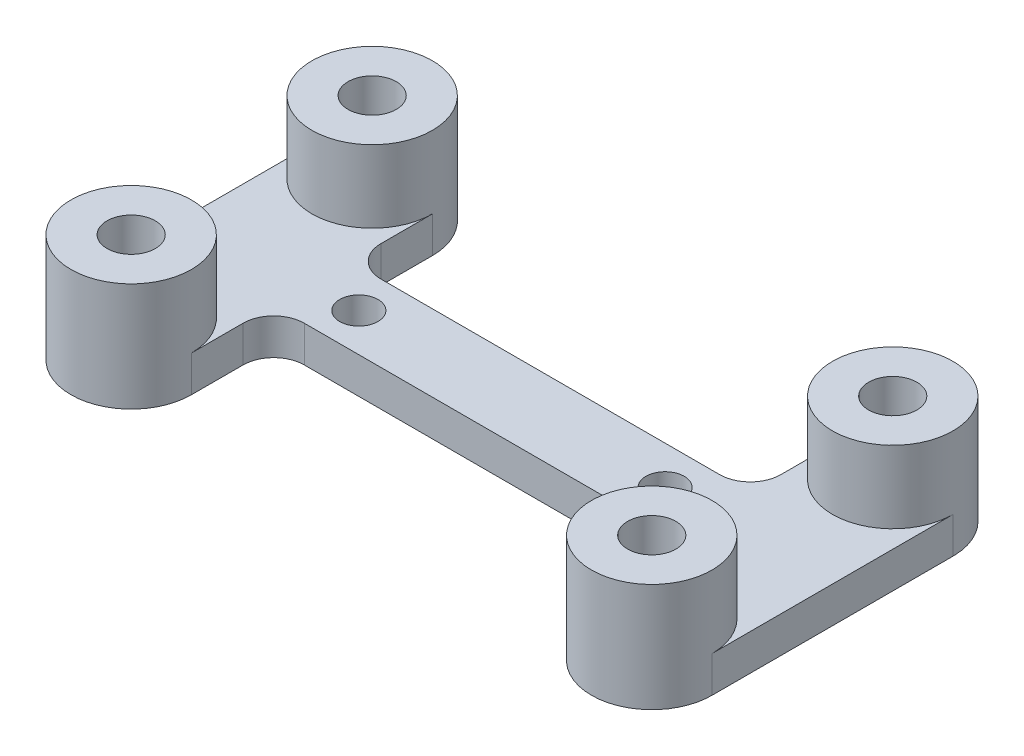
from build123d import *

# Parameters (mm, degrees)
SKETCH4_R             = 5
SKETCH4_R_2           = 2
BOSS_EXTRUDE3_DEPTH   = 9
BOSS_EXTRUDE3_2_DEPTH = 9
BOSS_EXTRUDE3_3_DEPTH = 9
BOSS_EXTRUDE3_4_DEPTH = 9
BOSS_EXTRUDE4_DEPTH   = 3
SKETCH6_R             = 1.5875
CUT_EXTRUDE1_DEPTH    = 32.110691506
FILLET1_R             = 2.54


with BuildPart() as part:
    # Sketch4 → Boss-Extrude3 (new body)
    with BuildSketch(Plane(origin=(0, 0, 0), x_dir=(1, 0, 0), z_dir=(0, 1, 0))):
        with Locations(Location((-21.59, 9.9949, 0), (0, 0, 270))):
            Circle(SKETCH4_R)
        with Locations(Location((-21.59, 9.9949, 0), (0, 0, 270))):
            Circle(SKETCH4_R_2, mode=Mode.SUBTRACT)
    extrude(amount=BOSS_EXTRUDE3_DEPTH)



with BuildPart() as body_2:
    # Sketch4 → Boss-Extrude3 2 (new body)
    with BuildSketch(Plane(origin=(0, 0, 0), x_dir=(1, 0, 0), z_dir=(0, 1, 0))):
        with Locations(Location((-21.59, -9.9949, 0), (0, 0, 270))):
            Circle(SKETCH4_R)
        with Locations(Location((-21.59, -9.9949, 0), (0, 0, 270))):
            Circle(SKETCH4_R_2, mode=Mode.SUBTRACT)
    extrude(amount=BOSS_EXTRUDE3_2_DEPTH)


with BuildPart() as body_3:
    # Sketch4 → Boss-Extrude3 3 (new body)
    with BuildSketch(Plane(origin=(0, 0, 0), x_dir=(1, 0, 0), z_dir=(0, 1, 0))):
        with Locations(Location((21.59, 9.9949, 0), (0, 0, 270))):
            Circle(SKETCH4_R)
        with Locations(Location((21.59, 9.9949, 0), (0, 0, 270))):
            Circle(SKETCH4_R_2, mode=Mode.SUBTRACT)
    extrude(amount=BOSS_EXTRUDE3_3_DEPTH)


with BuildPart() as body_4:
    # Sketch4 → Boss-Extrude3 4 (new body)
    with BuildSketch(Plane(origin=(0, 0, 0), x_dir=(1, 0, 0), z_dir=(0, 1, 0))):
        with Locations(Location((21.59, -9.9949, 0), (0, 0, 270))):
            Circle(SKETCH4_R)
        with Locations(Location((21.59, -9.9949, 0), (0, 0, 270))):
            Circle(SKETCH4_R_2, mode=Mode.SUBTRACT)
    extrude(amount=BOSS_EXTRUDE3_4_DEPTH)


with BuildPart() as part_1:
    add(part.part)

    add(body_2.part)  # Boss-Extrude4 merges body 2
    # Sketch5 → Boss-Extrude4 (add)
    with BuildSketch(Plane(origin=(0, 0, 0), x_dir=(1, 0, 0), z_dir=(0, 1, 0))):
        with BuildLine():
            ThreePointArc((-23.59, -9.9949), (-21.59, -7.9949), (-19.59, -9.9949))
            Line((-19.59, -9.9949), (-16.59, -9.9949))
            Line((-16.59, -9.9949), (-16.59, -3.175))
            Line((-16.59, -3.175), (0, -3.175))
            Line((0, -3.175), (0, 3.175))
            Line((0, 3.175), (-16.59, 3.175))
            Line((-16.59, 3.175), (-16.59, 9.9949))
            Line((-16.59, 9.9949), (-19.59, 9.9949))
            ThreePointArc((-19.59, 9.9949), (-21.59, 7.9949), (-23.59, 9.9949))
            Line((-23.59, 9.9949), (-26.59, 9.9949))
            Line((-26.59, 9.9949), (-26.59, -9.9949))
            Line((-26.59, -9.9949), (-23.59, -9.9949))
        make_face()
    boss_extrude4 = extrude(amount=BOSS_EXTRUDE4_DEPTH)

    # Mirror1: Boss-Extrude4 across plane
    add(boss_extrude4.mirror(Plane(origin=(0, 0, 0), x_dir=(0, 0, 1), z_dir=(1, 0, 0))))

    # Sketch6 → Cut-Extrude1 (cut, through all)
    with BuildSketch(Plane(origin=(0, 3, 0), x_dir=(1, 0, 0), z_dir=(0, 1, 0))):
        with Locations(Location((-12.7, 0, 0), (0, 0, 270))):
            Circle(SKETCH6_R)
        with Locations(Location((12.7, 0, 0), (0, 0, 270))):
            Circle(SKETCH6_R)
    extrude(amount=-CUT_EXTRUDE1_DEPTH, mode=Mode.SUBTRACT)

    # Fillet1
    fillet1_edges = [part_1.edges().sort_by_distance(p)[0] for p in [
        (-16.59, 1.5, 3.175),
        (-16.59, 1.5, -3.175),
        (16.59, 1.5, -3.175),
        (16.59, 1.5, 3.175),
    ]]
    fillet(fillet1_edges, radius=FILLET1_R)


solid = Compound([body_3.part, body_4.part, part_1.part])
